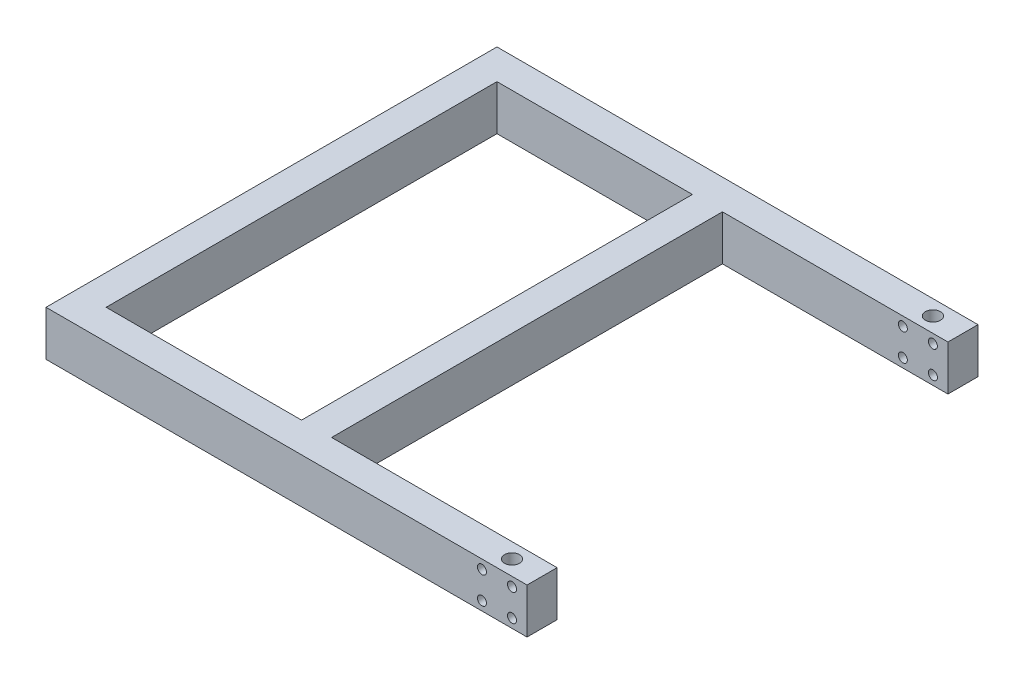
from build123d import *

# Parameters (mm, degrees)
SKETCH_2_W          = 10
SKETCH_2_H          = 130
EXTRUDE_1_DEPTH     = 15
SKETCH_3_R          = 1.5
CUT_EXTRUDE_1_DEPTH = 220.82947937
SKETCH_4_R          = 2.5
CUT_EXTRUDE_2_DEPTH = 7
SKETCH_5_R          = 2.5
CUT_EXTRUDE_3_DEPTH = 179.168652345


with BuildPart() as part:
    # 草图2 → 凸台-拉伸1 (new body)
    with BuildSketch(Plane(origin=(0, 0, 0), x_dir=(1, 0, 0), z_dir=(0, 1, 0))):
        Polygon((0, 73.064516129), (-85, 73.064516129), (-85, 63.064516129), (-75, 63.064516129), (0, 63.064516129), align=None)
        Polygon((-160, 73.064516129), (-160, 63.064516129), (-150, 63.064516129), (-85, 63.064516129), (-85, 73.064516129), align=None)
        with Locations((-80, -1.935483871)):
            Rectangle(SKETCH_2_W, SKETCH_2_H)
        Polygon((-85, -66.935483871), (-85, -76.935483871), (0, -76.935483871), (0, -66.935483871), (-75, -66.935483871), align=None)
        Polygon((-150, -66.935483871), (-160, -66.935483871), (-160, -76.935483871), (-85, -76.935483871), (-85, -66.935483871), align=None)
        with Locations((-155, -1.935483871)):
            Rectangle(SKETCH_2_W, SKETCH_2_H)
    extrude(amount=EXTRUDE_1_DEPTH)

    # 草图3 → 切除-拉伸1 (cut, through all)
    with BuildSketch(Plane.XY.offset(76.935483871)):
        with Locations((-5, 12)):
            Circle(SKETCH_3_R)
        with Locations((-5, 3)):
            Circle(SKETCH_3_R)
        with Locations((-15, 12)):
            Circle(SKETCH_3_R)
        with Locations((-15, 3)):
            Circle(SKETCH_3_R)
    extrude(amount=-CUT_EXTRUDE_1_DEPTH, mode=Mode.SUBTRACT)

    # 草图4 → 切除-拉伸2 (cut)
    with BuildSketch(Plane.ZY.offset(160)):
        with Locations((-63.064516129, 7.5)):
            Circle(SKETCH_4_R)
        with Locations((-13.064516129, 7.5)):
            Circle(SKETCH_4_R)
        with Locations((16.935483871, 7.5)):
            Circle(SKETCH_4_R)
        with Locations((66.935483871, 7.5)):
            Circle(SKETCH_4_R)
    extrude(amount=-CUT_EXTRUDE_2_DEPTH, mode=Mode.SUBTRACT)

    # 草图5 → 切除-拉伸3 (cut, through all)
    with BuildSketch(Plane(origin=(0, 15, 0), x_dir=(1, 0, 0), z_dir=(0, 1, 0))):
        with Locations(Location((-10, 68.064516129, 0), (0, 0, 270))):
            Circle(SKETCH_5_R)
        with Locations(Location((-10, -71.935483871, 0), (0, 0, 270))):
            Circle(SKETCH_5_R)
    extrude(amount=-CUT_EXTRUDE_3_DEPTH, mode=Mode.SUBTRACT)


solid = part.part
